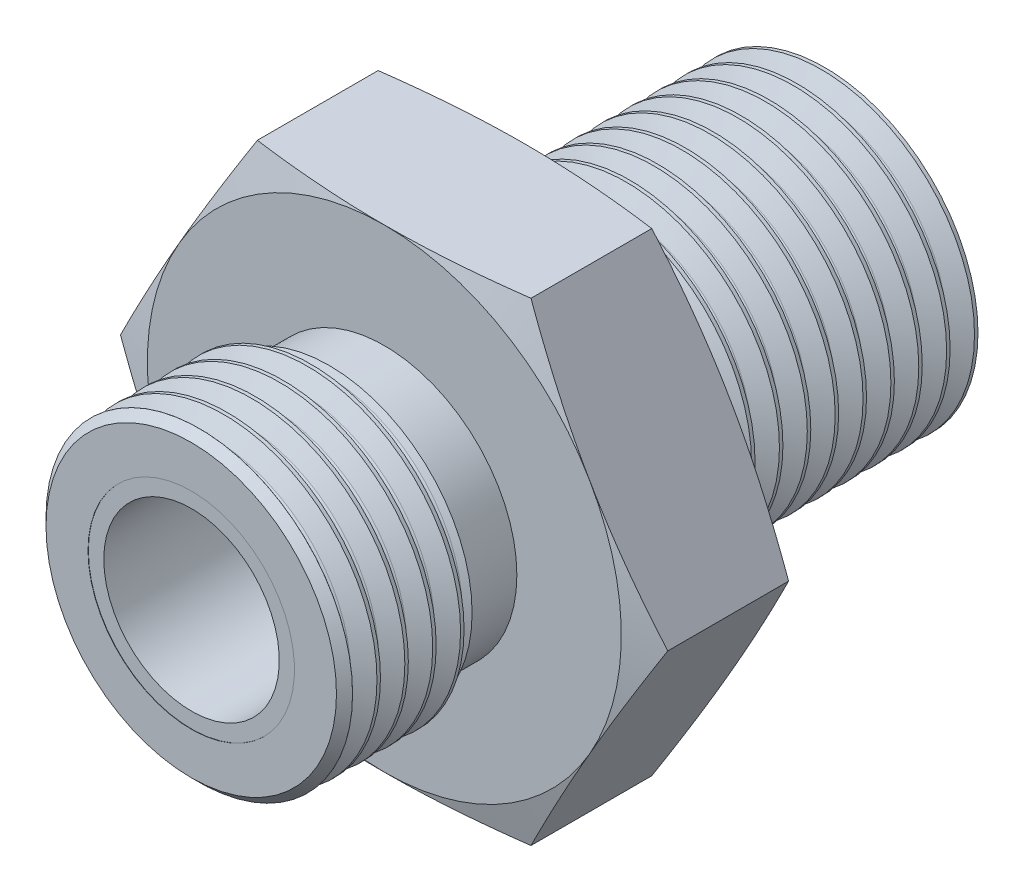
from build123d import *

# Parameters (mm, degrees)
BODY_DEPTH                = 53
THREAD_SIMPLE_RIGHT_COUNT = 20
THREAD_SIMPLE_RIGHT_PITCH = 1.5875
THREAD_SIMPLE_LEFT_COUNT  = 5
THREAD_SIMPLE_LEFT_PITCH  = 1.5875
SKETCH49_W                = 0.01713251
SKETCH49_H                = 0.981520858
SKETCH49_W_2              = 0.016877385
SKETCH49_H_2              = 0.966904756
SKETCH50_R                = 5
CUT_EXTRUDE1_DEPTH        = 36.5


with BuildPart() as part:
    # Sketch5 → Body (new body)
    with BuildSketch(Plane.XY.offset(-26.5)):
        Polygon((15.588457268, 0), (7.794228634, 13.5), (-7.794228634, 13.5), (-15.588457268, 0), (-7.794228634, -13.5), (7.794228634, -13.5), align=None)
    extrude(amount=BODY_DEPTH)

    # Sketch21 → Cut-Body-Thread-Right (revolve, cut)
    with BuildSketch(Plane(origin=(0, 0, 0), x_dir=(0, 0, -1), z_dir=(1, 0, 0)), mode=Mode.PRIVATE) as cut_body_thread_right_sk:
        Polygon((-4.7, 8.73125), (26.042414577, 8.73125), (26.5, 8.273664577), (26.5, 15.588457268), (-4.7, 15.588457268), align=None)
    revolve(cut_body_thread_right_sk.sketch.rotate(Axis((0, 0, -26.5), (0, 0, 1)), 90), axis=Axis((0, 0, -26.5), (0, 0, 1)), mode=Mode.SUBTRACT)

    # Sketch25 → Thread-Single-Right (revolve, cut)
    with BuildSketch(Plane(origin=(0, 0, 0), x_dir=(0, 0, -1), z_dir=(1, 0, 0)), mode=Mode.PRIVATE) as thread_single_right_sk:
        with BuildLine():
            Line((-3.3109375, 8.73125), (-4.7, 8.73125))
            Line((-4.7, 8.73125), (-4.161597037, 7.696987531))
            ThreePointArc((-4.161597037, 7.696987531), (-4.00546875, 7.602246561), (-3.849340463, 7.696987531))
            Line((-3.849340463, 7.696987531), (-3.3109375, 8.73125))
        make_face()
    thread_single_right = revolve(thread_single_right_sk.sketch.rotate(Axis((0, 0, -26.5), (0, 0, 1)), 90), axis=Axis((0, 0, -26.5), (0, 0, 1)), mode=Mode.SUBTRACT)

    # Thread-Simple-Right: Thread-Single-Right ×20
    with Locations(*[(0, 0, -i * THREAD_SIMPLE_RIGHT_PITCH) for i in range(1, THREAD_SIMPLE_RIGHT_COUNT)]):
        add(thread_single_right, mode=Mode.SUBTRACT)

    # Sketch32 → Cut-Body-Thread-Left (revolve, cut)
    with BuildSketch(Plane(origin=(0, 0, 0), x_dir=(0, 0, -1), z_dir=(1, 0, 0)), mode=Mode.PRIVATE) as cut_body_thread_left_sk:
        Polygon((-26.5, 15.588457268), (-26.5, 8.273664577), (-26.042414577, 8.73125), (-18.3, 8.73125), (-18.3, 15.588457268), align=None)
    revolve(cut_body_thread_left_sk.sketch.rotate(Axis((0, 0, -26.5), (0, 0, 1)), 90), axis=Axis((0, 0, -26.5), (0, 0, 1)), mode=Mode.SUBTRACT)

    # Sketch33 → Thread-Single-Left (revolve, cut)
    with BuildSketch(Plane(origin=(0, 0, 0), x_dir=(0, 0, -1), z_dir=(1, 0, 0)), mode=Mode.PRIVATE) as thread_single_left_sk:
        with BuildLine():
            Line((-18.3, 8.73125), (-18.845703125, 7.786064462))
            ThreePointArc((-18.845703125, 7.786064462), (-18.99453125, 7.700138504), (-19.143359375, 7.786064462))
            Line((-19.143359375, 7.786064462), (-19.6890625, 8.73125))
            Line((-19.6890625, 8.73125), (-18.3, 8.73125))
        make_face()
    thread_single_left = revolve(thread_single_left_sk.sketch.rotate(Axis((0, 0, -26.5), (0, 0, 1)), 90), axis=Axis((0, 0, -26.5), (0, 0, 1)), mode=Mode.SUBTRACT)

    # Thread-Simple-Left: Thread-Single-Left ×5
    with Locations(*[(0, 0, i * THREAD_SIMPLE_LEFT_PITCH) for i in range(1, THREAD_SIMPLE_LEFT_COUNT)]):
        add(thread_single_left, mode=Mode.SUBTRACT)

    # Sketch45 → Cut-Connection-Right (revolve, cut)
    with BuildSketch(Plane(origin=(0, 0, 0), x_dir=(0, 0, -1), z_dir=(1, 0, 0)), mode=Mode.PRIVATE) as cut_connection_right_sk:
        Polygon((-4.7, 7.55), (-7.5, 7.55), (-7.5, 13.5), (-8.059600438, 15.588457268), (-4.018004995, 15.588457268), (-4.018004995, 8.73125), align=None)
    revolve(cut_connection_right_sk.sketch.rotate(Axis((0, 0, -26.5), (0, 0, 1)), 90), axis=Axis((0, 0, -26.5), (0, 0, 1)), mode=Mode.SUBTRACT)

    # Sketch46 → Cut-Connection-Left (revolve, cut)
    with BuildSketch(Plane(origin=(0, 0, 0), x_dir=(0, 0, -1), z_dir=(1, 0, 0)), mode=Mode.PRIVATE) as cut_connection_left_sk:
        Polygon((-18.3, 7.55), (-18.981995005, 8.73125), (-18.981995005, 15.588457268), (-14.940399562, 15.588457268), (-15.5, 13.5), (-15.5, 7.55), align=None)
    revolve(cut_connection_left_sk.sketch.rotate(Axis((0, 0, -26.5), (0, 0, 1)), 90), axis=Axis((0, 0, -26.5), (0, 0, 1)), mode=Mode.SUBTRACT)

    # Sketch11 → Cut-Hole-Right (revolve, cut)
    with BuildSketch(Plane(origin=(0, 0, 0), x_dir=(0, 0, -1), z_dir=(0, 1, 0))):
        Polygon((26.5, 3.25), (26.5, 0), (-1.876388375, 0), (0, 3.25), align=None)
    revolve(axis=Axis((0, 0, -26.5), (0, 0, 1)), mode=Mode.SUBTRACT)

    # Sketch16 → Cut-Hole-Left (revolve, cut)
    with BuildSketch(Plane(origin=(0, 0, 0), x_dir=(1, 0, 0), z_dir=(0, 1, 0)), mode=Mode.PRIVATE) as cut_hole_left_sk:
        Polygon((0, 1.876388375), (-3.25, 0), (-3.25, -26.5), (0, -26.5), align=None)
    revolve(cut_hole_left_sk.sketch.rotate(Axis((0, 0, 1.876388375), (0, 0, -1)), 180), axis=Axis((0, 0, 1.876388375), (0, 0, -1)), mode=Mode.SUBTRACT)

    # Sketch49 → o-ring (revolve, cut)
    with BuildSketch(Plane(origin=(0, 0, 0), x_dir=(0, 0, -1), z_dir=(1, 0, 0)), mode=Mode.PRIVATE) as o_ring_sk:
        with Locations((-26.491433745, 5.389143294)):
            Rectangle(SKETCH49_W, SKETCH49_H)
        with Locations((26.491561307, 5.323533941)):
            Rectangle(SKETCH49_W_2, SKETCH49_H_2)
    revolve(o_ring_sk.sketch.rotate(Axis((0, 0, -26.5), (0, 0, 1)), 90), axis=Axis((0, 0, -26.5), (0, 0, 1)), mode=Mode.SUBTRACT)


with BuildPart() as body_2:
    # Split1: the piece on the far side of the plane
    add(part.part)
    split(bisect_by=Plane.XY.offset(-10), keep=Keep.BOTTOM)


with BuildPart() as part_1:
    add(part.part)

    # Split1
    split(bisect_by=Plane.XY.offset(-10), keep=Keep.TOP)

    # Sketch50 → Cut-Extrude1 (cut)
    with BuildSketch(Plane(origin=(0, 0, -10), x_dir=(-1, 0, 0), z_dir=(0, 0, -1))):
        Circle(SKETCH50_R)
    extrude(amount=-CUT_EXTRUDE1_DEPTH, mode=Mode.SUBTRACT)


solid = part_1.part
